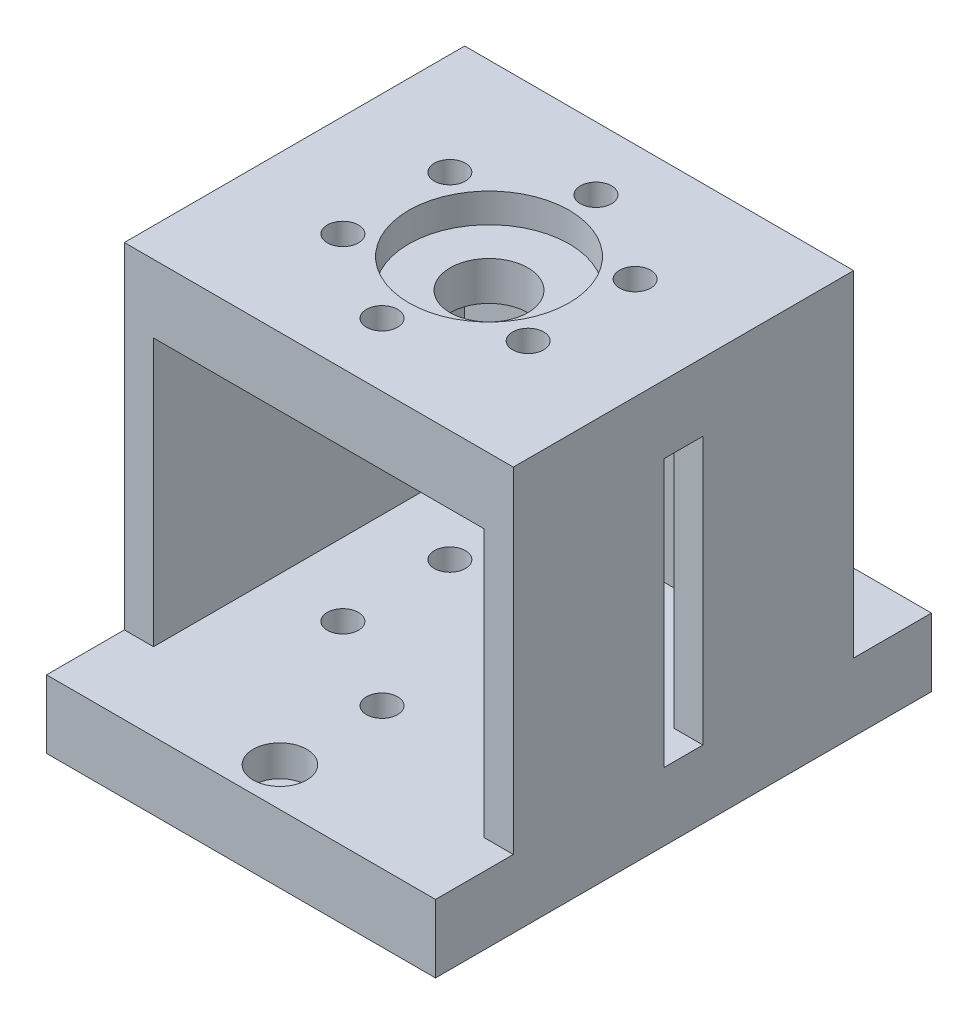
from build123d import *

# Parameters (mm, degrees)
SKETCH1_W           = 40
SKETCH1_H           = 35
BOSS_EXTRUDE1_DEPTH = 7
BOSS_EXTRUDE2_DEPTH = 27.5
SKETCH3_W           = 40
SKETCH3_H           = 35
BOSS_EXTRUDE3_DEPTH = 7
SKETCH4_R           = 1.6
SKETCH4_R_2         = 4
CUT_EXTRUDE1_DEPTH  = 57
SKETCH5_R           = 2.75
CUT_EXTRUDE2_DEPTH  = 3.2
SKETCH6_R           = 8.25
CUT_EXTRUDE3_DEPTH  = 3
SKETCH7_W           = 4
SKETCH7_H           = 27.5
CUT_EXTRUDE4_DEPTH  = 12.4
SKETCH8_W           = 40
SKETCH8_H           = 8
SKETCH8_R           = 1.65
BOSS_EXTRUDE4_DEPTH = 7
SKETCH10_R          = 2.75
CUT_EXTRUDE5_DEPTH  = 3.2
BOSS_EXTRUDE5_START = -7
SKETCH11_R          = 4
BOSS_EXTRUDE5_DEPTH = 7


with BuildPart() as part:
    # Sketch1 → Boss-Extrude1 (new body)
    with BuildSketch(Plane(origin=(0, 0, 0), x_dir=(1, 0, 0), z_dir=(0, 1, 0))):
        Rectangle(SKETCH1_W, SKETCH1_H)
    extrude(amount=BOSS_EXTRUDE1_DEPTH)

    # Sketch2 → Boss-Extrude2 (add)
    with BuildSketch(Plane(origin=(0, 7, 0), x_dir=(1, 0, 0), z_dir=(0, 1, 0))):
        Polygon((-20, -17.5), (-17, -17.5), (-17, 14.5), (17, 14.5), (17, -17.5), (20, -17.5), (20, 17.5), (-20, 17.5), align=None)
    extrude(amount=BOSS_EXTRUDE2_DEPTH)

    # Sketch3 → Boss-Extrude3 (add)
    with BuildSketch(Plane(origin=(0, 34.5, 0), x_dir=(1, 0, 0), z_dir=(0, 1, 0))):
        Rectangle(SKETCH3_W, SKETCH3_H)
    extrude(amount=BOSS_EXTRUDE3_DEPTH)

    # Sketch4 → Cut-Extrude1 (cut)
    with BuildSketch(Plane(origin=(0, 41.5, 0), x_dir=(1, 0, 0), z_dir=(0, 1, 0))):
        with Locations(Location((0, 11, 0), (0, 0, 270))):
            Circle(SKETCH4_R)
        with Locations(Location((9.526279442, 5.5, 0), (0, 0, 270))):
            Circle(SKETCH4_R)
        with Locations(Location((9.526279442, -5.5, 0), (0, 0, 270))):
            Circle(SKETCH4_R)
        with Locations(Location((0, -11, 0), (0, 0, 270))):
            Circle(SKETCH4_R)
        with Locations(Location((-9.526279442, -5.5, 0), (0, 0, 270))):
            Circle(SKETCH4_R)
        with Locations(Location((-9.526279442, 5.5, 0), (0, 0, 270))):
            Circle(SKETCH4_R)
        with Locations(Location((0, 0, 0), (0, 0, 270))):
            Circle(SKETCH4_R_2)
    extrude(amount=-CUT_EXTRUDE1_DEPTH, mode=Mode.SUBTRACT)

    # Sketch5 → Cut-Extrude2 (cut)
    with BuildSketch(Plane.XZ.offset(-34.5)):
        with Locations(Location((0, 11, 0), (0, 0, 270))):
            Circle(SKETCH5_R)
        with Locations(Location((0, -11, 0), (0, 0, 270))):
            Circle(SKETCH5_R)
        with Locations(Location((9.526279442, -5.5, 0), (0, 0, 270))):
            Circle(SKETCH5_R)
        with Locations(Location((9.526279442, 5.5, 0), (0, 0, 270))):
            Circle(SKETCH5_R)
        with Locations(Location((-9.526279442, 5.5, 0), (0, 0, 270))):
            Circle(SKETCH5_R)
        with Locations(Location((-9.526279442, -5.5, 0), (0, 0, 270))):
            Circle(SKETCH5_R)
    extrude(amount=-CUT_EXTRUDE2_DEPTH, mode=Mode.SUBTRACT)

    # Sketch6 → Cut-Extrude3 (cut)
    with BuildSketch(Plane(origin=(0, 41.5, 0), x_dir=(1, 0, 0), z_dir=(0, 1, 0))):
        with Locations(Location((0, 0, 0), (0, 0, 270))):
            Circle(SKETCH6_R)
    extrude(amount=-CUT_EXTRUDE3_DEPTH, mode=Mode.SUBTRACT)

    # Sketch7 → Cut-Extrude4 (cut)
    with BuildSketch(Plane(origin=(20, 0, 0), x_dir=(0, 0, -1), z_dir=(1, 0, 0))):
        with Locations((0, 20.75)):
            Rectangle(SKETCH7_W, SKETCH7_H)
    extrude(amount=-CUT_EXTRUDE4_DEPTH, mode=Mode.SUBTRACT)

    # Sketch8 → Boss-Extrude4 (add)
    # profile 1 of 2: a face of its own
    with BuildSketch(Plane(origin=(0, 0, 0), x_dir=(1, 0, 0), z_dir=(0, 1, 0))):
        with Locations((0, -21.5)):
            Rectangle(SKETCH8_W, SKETCH8_H)
        with Locations(Location((0, -21.5, 0), (0, 0, 90))):
            Circle(SKETCH8_R, mode=Mode.SUBTRACT)
    # profile 2 of 2: a face of its own
    with BuildSketch(Plane(origin=(0, 0, 0), x_dir=(1, 0, 0), z_dir=(0, 1, 0))):
        with Locations((0, 21.5)):
            Rectangle(SKETCH8_W, SKETCH8_H)
        with Locations(Location((0, 21.5, 0), (0, 0, 90))):
            Circle(SKETCH8_R, mode=Mode.SUBTRACT)
    extrude(amount=BOSS_EXTRUDE4_DEPTH)

    # Sketch10 → Cut-Extrude5 (cut)
    with BuildSketch(Plane(origin=(0, 7, 0), x_dir=(1, 0, 0), z_dir=(0, 1, 0))):
        with Locations(Location((0, 21.5, 0), (0, 0, 270))):
            Circle(SKETCH10_R)
        with Locations(Location((0, -21.5, 0), (0, 0, 270))):
            Circle(SKETCH10_R)
    extrude(amount=-CUT_EXTRUDE5_DEPTH, mode=Mode.SUBTRACT)

    # Sketch11 → Boss-Extrude5 (add)
    with BuildSketch(Plane.XZ.offset(BOSS_EXTRUDE5_START)):
        with Locations(Location((0, 0, 0), (0, 0, 90))):
            Circle(SKETCH11_R)
    extrude(amount=BOSS_EXTRUDE5_DEPTH)


solid = part.part
